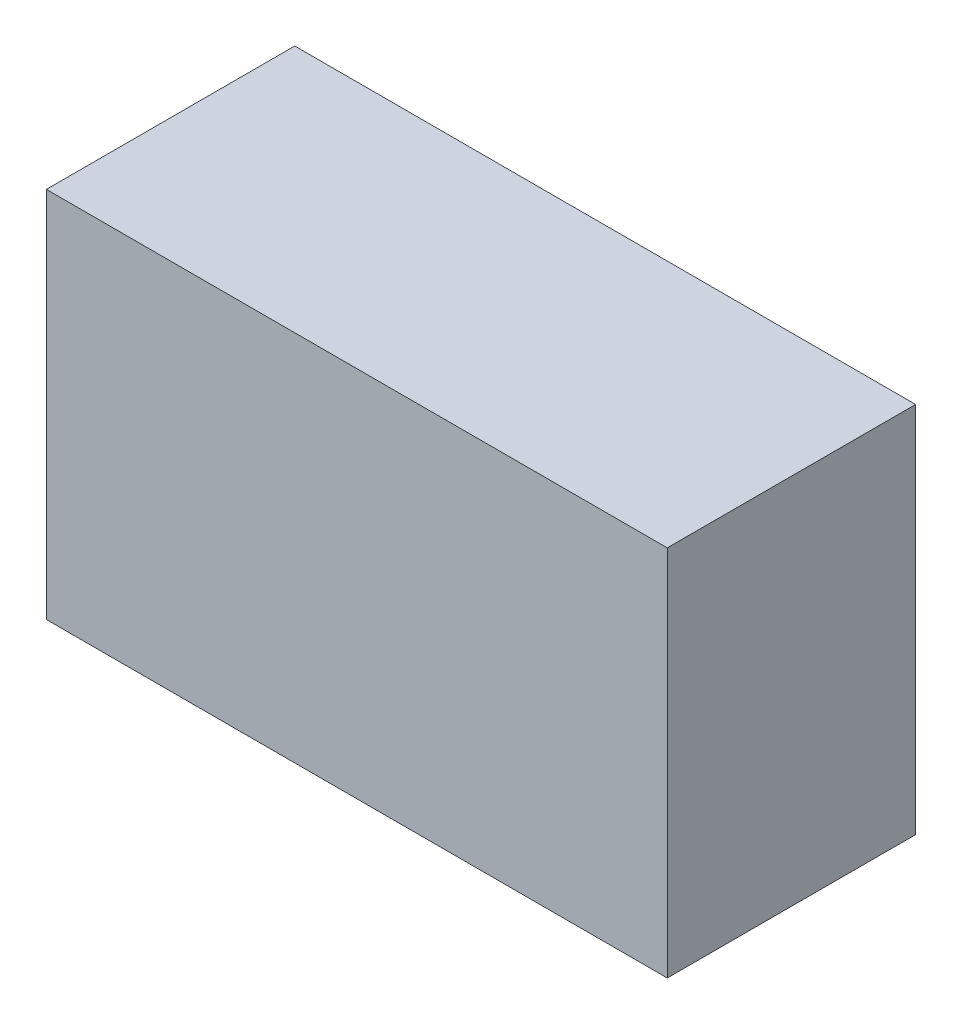
from build123d import *

# Parameters (mm, degrees)
SKETCH_1_W      = 25
SKETCH_1_H      = 15
EXTRUDE_1_DEPTH = 10


with BuildPart() as part:
    # 草图1 → 凸台-拉伸1 (new body)
    with BuildSketch(Plane.XY):
        with Locations((8.3125, 3.65625)):
            Rectangle(SKETCH_1_W, SKETCH_1_H)
    extrude(amount=EXTRUDE_1_DEPTH)


solid = part.part
